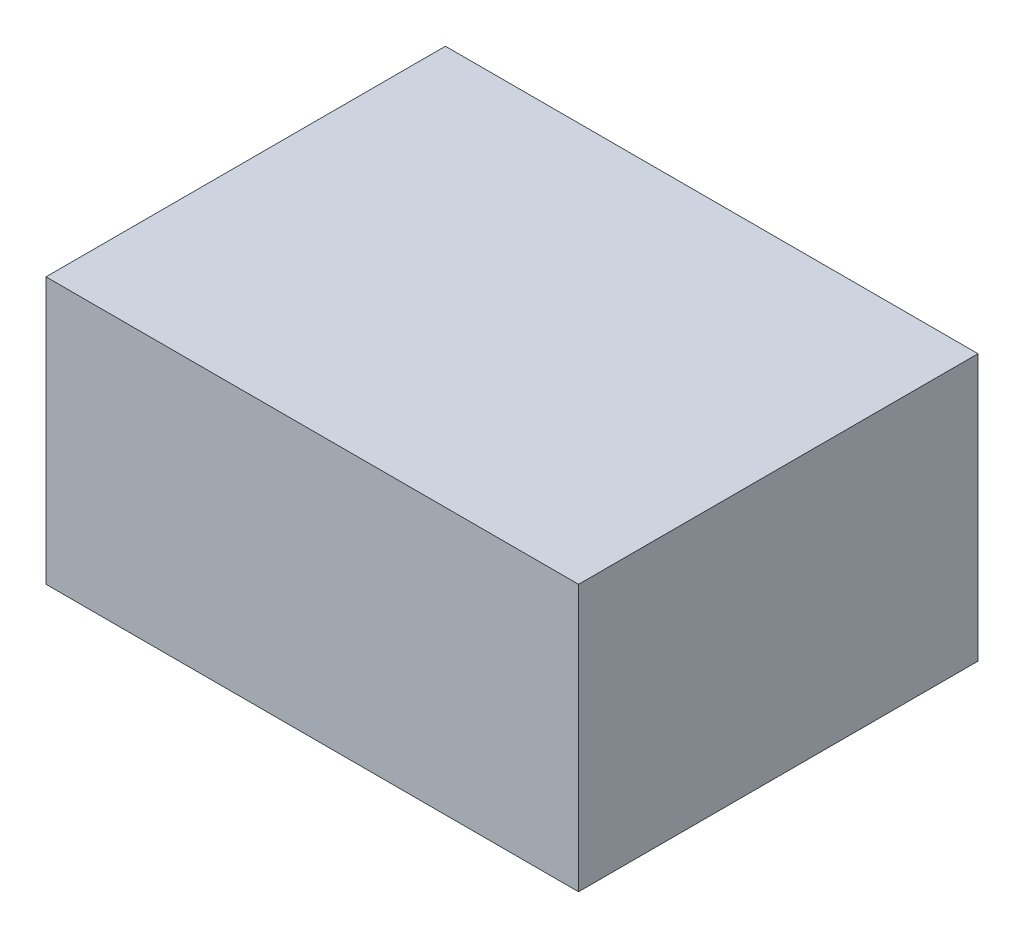
from build123d import *
from OCP.BRepFilletAPI import BRepFilletAPI_MakeChamfer

# Parameters (mm, degrees)
SKETCH1_W           = 60
SKETCH1_H           = 45
BOSS_EXTRUDE1_DEPTH = 30
SKETCH2_W           = 8
SKETCH2_H           = 16
CUT_EXTRUDE1_DEPTH  = 20
CHAMFER1_SIZE       = 15
CHAMFER1_SIZE2      = 1.312329953
CHAMFER2_SIZE       = 5
CHAMFER2_SIZE2      = 5.958767963
CUT_EXTRUDE2_DEPTH  = 10


with BuildPart() as part:
    # Sketch1 → Boss-Extrude1 (new body)
    with BuildSketch(Plane(origin=(0, 0, 0), x_dir=(1, 0, 0), z_dir=(0, 1, 0))):
        with Locations((-30, 22.5)):
            Rectangle(SKETCH1_W, SKETCH1_H)
    extrude(amount=BOSS_EXTRUDE1_DEPTH)

    # Sketch2 → Cut-Extrude1 (cut)
    with BuildSketch(Plane(origin=(0, 0, 0), x_dir=(-1, 0, 0), z_dir=(0, -1, 0))):
        with Locations((47, 21)):
            Rectangle(SKETCH2_W, SKETCH2_H)
        with Locations((13, 21)):
            Rectangle(SKETCH2_W, SKETCH2_H)
    extrude(amount=-CUT_EXTRUDE1_DEPTH, mode=Mode.SUBTRACT)

    # Chamfer1: one chamfer whose edges measure the first distance from different faces: ONE call of the kernel's chamfer builder (chamfer() names one face for all edges)
    chamfer1_edges_1 = [part.edges().sort_by_distance(p)[0] for p in [
        (-51, 20, -21),
    ]]
    chamfer1_side_1 = [part.faces().sort_by_distance(p)[0] for p in [
        (-51, 10, -21),
    ]]
    chamfer1_edges_2 = [part.edges().sort_by_distance(p)[0] for p in [
        (-43, 20, -21),
    ]]
    chamfer1_side_2 = [part.faces().sort_by_distance(p)[0] for p in [
        (-43, 10, -21),
    ]]
    chamfer1_edges_3 = [part.edges().sort_by_distance(p)[0] for p in [
        (-17, 20, -21),
    ]]
    chamfer1_side_3 = [part.faces().sort_by_distance(p)[0] for p in [
        (-17, 10, -21),
    ]]
    chamfer1_edges_4 = [part.edges().sort_by_distance(p)[0] for p in [
        (-9, 20, -21),
    ]]
    chamfer1_side_4 = [part.faces().sort_by_distance(p)[0] for p in [
        (-9, 10, -21),
    ]]
    chamfer1 = BRepFilletAPI_MakeChamfer(part.part.solid().wrapped)
    for e in chamfer1_edges_1:
        chamfer1.Add(CHAMFER1_SIZE, CHAMFER1_SIZE2, e.wrapped, chamfer1_side_1[0].wrapped)  # the first distance lies on this face
    for e in chamfer1_edges_2:
        chamfer1.Add(CHAMFER1_SIZE, CHAMFER1_SIZE2, e.wrapped, chamfer1_side_2[0].wrapped)  # the first distance lies on this face
    for e in chamfer1_edges_3:
        chamfer1.Add(CHAMFER1_SIZE, CHAMFER1_SIZE2, e.wrapped, chamfer1_side_3[0].wrapped)  # the first distance lies on this face
    for e in chamfer1_edges_4:
        chamfer1.Add(CHAMFER1_SIZE, CHAMFER1_SIZE2, e.wrapped, chamfer1_side_4[0].wrapped)  # the first distance lies on this face
    add(Compound.cast(chamfer1.Shape()), mode=Mode.REPLACE)

    # Chamfer2: one chamfer whose edges measure the first distance from different faces: ONE call of the kernel's chamfer builder (chamfer() names one face for all edges)
    chamfer2_edges_1 = [part.edges().sort_by_distance(p)[0] for p in [
        (-13, 20, -29),
    ]]
    chamfer2_side_1 = [part.faces().sort_by_distance(p)[0] for p in [
        (-13, 9.298544625, -29),
    ]]
    chamfer2_edges_2 = [part.edges().sort_by_distance(p)[0] for p in [
        (-13, 20, -13),
    ]]
    chamfer2_side_2 = [part.faces().sort_by_distance(p)[0] for p in [
        (-13, 9.298544625, -13),
    ]]
    chamfer2_edges_3 = [part.edges().sort_by_distance(p)[0] for p in [
        (-47, 20, -29),
    ]]
    chamfer2_side_3 = [part.faces().sort_by_distance(p)[0] for p in [
        (-47, 9.298544625, -29),
    ]]
    chamfer2_edges_4 = [part.edges().sort_by_distance(p)[0] for p in [
        (-47, 20, -13),
    ]]
    chamfer2_side_4 = [part.faces().sort_by_distance(p)[0] for p in [
        (-47, 9.298544625, -13),
    ]]
    chamfer2 = BRepFilletAPI_MakeChamfer(part.part.solid().wrapped)
    for e in chamfer2_edges_1:
        chamfer2.Add(CHAMFER2_SIZE, CHAMFER2_SIZE2, e.wrapped, chamfer2_side_1[0].wrapped)  # the first distance lies on this face
    for e in chamfer2_edges_2:
        chamfer2.Add(CHAMFER2_SIZE, CHAMFER2_SIZE2, e.wrapped, chamfer2_side_2[0].wrapped)  # the first distance lies on this face
    for e in chamfer2_edges_3:
        chamfer2.Add(CHAMFER2_SIZE, CHAMFER2_SIZE2, e.wrapped, chamfer2_side_3[0].wrapped)  # the first distance lies on this face
    for e in chamfer2_edges_4:
        chamfer2.Add(CHAMFER2_SIZE, CHAMFER2_SIZE2, e.wrapped, chamfer2_side_4[0].wrapped)  # the first distance lies on this face
    add(Compound.cast(chamfer2.Shape()), mode=Mode.REPLACE)

    # Sketch4 → Cut-Extrude2 (cut)
    with BuildSketch(Plane(origin=(0, 0, -45), x_dir=(-1, 0, 0), z_dir=(0, 0, -1))):
        with BuildLine():
            Line((10, 0), (28.5, 0))
            ThreePointArc((28.5, 0), (34.073421984, 6.184666101), (42.397874378, 6.313583642))
            ThreePointArc((42.397874378, 6.313583642), (46.400635454, 7.606885175), (45.740315255, 11.761244612))
            ThreePointArc((45.740315255, 11.761244612), (24.568698428, 15.91316533), (10, 0))
        make_face()
    extrude(amount=-CUT_EXTRUDE2_DEPTH, mode=Mode.SUBTRACT)


solid = part.part
